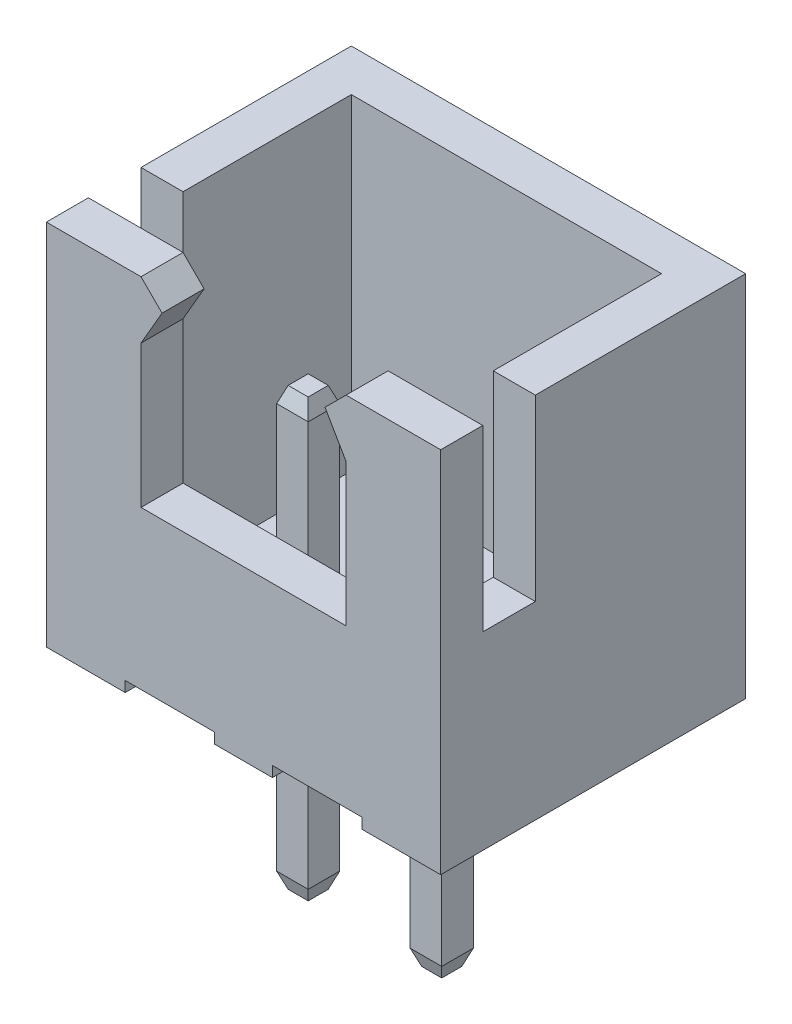
from build123d import *
from OCP.BRepFilletAPI import BRepFilletAPI_MakeChamfer

# Parameters (mm, degrees)
SKETCH_1_W               = 7.5
SKETCH_1_H               = 5.8
EXTRUDE_1_DEPTH          = 7
CUT_EXTRUDE_1_DEPTH      = 9.454140997
CUT_EXTRUDE_1_DEPTH_BACK = 9.454140997
SKETCH_2_W               = 1.7
SKETCH_2_H               = 0.2
SKETCH_3_W               = 5.9
SKETCH_3_H               = 4.2
CUT_EXTRUDE_2_DEPTH      = 6.2
CUT_EXTRUDE_3_DEPTH      = 1
CUT_EXTRUDE_4_DEPTH      = 9.454140997
CUT_EXTRUDE_4_DEPTH_BACK = 9.454140997
SKETCH_5_W               = 1
SKETCH_5_H               = 3.4
SKETCH_6_W               = 0.6
SKETCH_6_H               = 0.6
EXTRUDE_3_DEPTH          = 4.2
SKETCH_7_W               = 0.6
SKETCH_7_H               = 0.6
EXTRUDE_4_DEPTH          = 3.5
CHAMFER_1_SIZE           = 0.3
CHAMFER_1_SIZE2          = 0.10919107


with BuildPart() as part:
    # 草图1 → 凸台-拉伸1 (new body)
    with BuildSketch(Plane(origin=(0, 0, 0), x_dir=(1, 0, 0), z_dir=(0, 1, 0))):
        Rectangle(SKETCH_1_W, SKETCH_1_H)
    extrude(amount=EXTRUDE_1_DEPTH)

    # 草图2 → 切除-拉伸1 (cut, two sides: drawn at the far end of the back side and taken through both)
    with BuildSketch(Plane.XY.offset(-CUT_EXTRUDE_1_DEPTH_BACK)):
        with Locations((-1.4, 0.1)):
            Rectangle(SKETCH_2_W, SKETCH_2_H)
        with Locations((1.4, 0.1)):
            Rectangle(SKETCH_2_W, SKETCH_2_H)
    extrude(amount=CUT_EXTRUDE_1_DEPTH + CUT_EXTRUDE_1_DEPTH_BACK, mode=Mode.SUBTRACT)

    # 草图3 → 切除-拉伸2 (cut)
    with BuildSketch(Plane(origin=(0, 7, 0), x_dir=(1, 0, 0), z_dir=(0, 1, 0))):
        Rectangle(SKETCH_3_W, SKETCH_3_H)
    extrude(amount=-CUT_EXTRUDE_2_DEPTH, mode=Mode.SUBTRACT)

    # 草图4 → 切除-拉伸3 (cut)
    with BuildSketch(Plane.XY.offset(2.9)):
        Polygon((-1.95, 7), (-1.55, 6.6), (-1.95, 5.907179677), (-1.95, 3.2), (1.95, 3.2), (1.95, 5.907179677), (1.55, 6.6), (1.95, 7), align=None)
    extrude(amount=-CUT_EXTRUDE_3_DEPTH, mode=Mode.SUBTRACT)

    # 草图5 → 切除-拉伸4 (cut, two sides: drawn at the far end of the back side and taken through both)
    with BuildSketch(Plane.ZY.offset(-CUT_EXTRUDE_4_DEPTH_BACK)):
        with Locations((1.6, 5.3)):
            Rectangle(SKETCH_5_W, SKETCH_5_H)
    extrude(amount=CUT_EXTRUDE_4_DEPTH + CUT_EXTRUDE_4_DEPTH_BACK, mode=Mode.SUBTRACT)

    # 草图6 → 凸台-拉伸3 (add)
    with BuildSketch(Plane.XZ.offset(-0.2)):
        with Locations((-1.27, 0.4)):
            Rectangle(SKETCH_6_W, SKETCH_6_H)
        with Locations((1.27, 0.4)):
            Rectangle(SKETCH_6_W, SKETCH_6_H)
    extrude(amount=EXTRUDE_3_DEPTH)

    # 草图7 → 凸台-拉伸4 (add)
    with BuildSketch(Plane(origin=(0, 0.8, 0), x_dir=(1, 0, 0), z_dir=(0, 1, 0))):
        with Locations((1.27, -0.4)):
            Rectangle(SKETCH_7_W, SKETCH_7_H)
        with Locations((-1.27, -0.4)):
            Rectangle(SKETCH_7_W, SKETCH_7_H)
    extrude(amount=EXTRUDE_4_DEPTH)

    # 倒角1: one chamfer whose edges measure the first distance from different faces: ONE call of the kernel's chamfer builder (chamfer() names one face for all edges)
    chamfer_1_edges_1 = [part.edges().sort_by_distance(p)[0] for p in [
        (-1.27, -4, 0.7),
    ]]
    chamfer_1_side_1 = [part.faces().sort_by_distance(p)[0] for p in [
        (-1.27, -1.9, 0.7),
    ]]
    chamfer_1_edges_2 = [part.edges().sort_by_distance(p)[0] for p in [
        (-1.57, -4, 0.4),
    ]]
    chamfer_1_side_2 = [part.faces().sort_by_distance(p)[0] for p in [
        (-1.57, -1.9, 0.4),
    ]]
    chamfer_1_edges_3 = [part.edges().sort_by_distance(p)[0] for p in [
        (-1.27, -4, 0.1),
    ]]
    chamfer_1_side_3 = [part.faces().sort_by_distance(p)[0] for p in [
        (-1.27, -1.9, 0.1),
    ]]
    chamfer_1_edges_4 = [part.edges().sort_by_distance(p)[0] for p in [
        (-0.97, -4, 0.4),
    ]]
    chamfer_1_side_4 = [part.faces().sort_by_distance(p)[0] for p in [
        (-0.97, -1.9, 0.4),
    ]]
    chamfer_1_edges_5 = [part.edges().sort_by_distance(p)[0] for p in [
        (1.27, -4, 0.1),
    ]]
    chamfer_1_side_5 = [part.faces().sort_by_distance(p)[0] for p in [
        (1.27, -1.9, 0.1),
    ]]
    chamfer_1_edges_6 = [part.edges().sort_by_distance(p)[0] for p in [
        (1.57, -4, 0.4),
    ]]
    chamfer_1_side_6 = [part.faces().sort_by_distance(p)[0] for p in [
        (1.57, -1.9, 0.4),
    ]]
    chamfer_1_edges_7 = [part.edges().sort_by_distance(p)[0] for p in [
        (1.27, -4, 0.7),
    ]]
    chamfer_1_side_7 = [part.faces().sort_by_distance(p)[0] for p in [
        (1.27, -1.9, 0.7),
    ]]
    chamfer_1_edges_8 = [part.edges().sort_by_distance(p)[0] for p in [
        (0.97, -4, 0.4),
    ]]
    chamfer_1_side_8 = [part.faces().sort_by_distance(p)[0] for p in [
        (0.97, -1.9, 0.4),
    ]]
    chamfer_1_edges_9 = [part.edges().sort_by_distance(p)[0] for p in [
        (1.27, 4.3, 0.7),
    ]]
    chamfer_1_side_9 = [part.faces().sort_by_distance(p)[0] for p in [
        (1.27, 2.55, 0.7),
    ]]
    chamfer_1_edges_10 = [part.edges().sort_by_distance(p)[0] for p in [
        (1.57, 4.3, 0.4),
    ]]
    chamfer_1_side_10 = [part.faces().sort_by_distance(p)[0] for p in [
        (1.57, 2.55, 0.4),
    ]]
    chamfer_1_edges_11 = [part.edges().sort_by_distance(p)[0] for p in [
        (1.27, 4.3, 0.1),
    ]]
    chamfer_1_side_11 = [part.faces().sort_by_distance(p)[0] for p in [
        (1.27, 2.55, 0.1),
    ]]
    chamfer_1_edges_12 = [part.edges().sort_by_distance(p)[0] for p in [
        (0.97, 4.3, 0.4),
    ]]
    chamfer_1_side_12 = [part.faces().sort_by_distance(p)[0] for p in [
        (0.97, 2.55, 0.4),
    ]]
    chamfer_1_edges_13 = [part.edges().sort_by_distance(p)[0] for p in [
        (-1.57, 4.3, 0.4),
    ]]
    chamfer_1_side_13 = [part.faces().sort_by_distance(p)[0] for p in [
        (-1.57, 2.55, 0.4),
    ]]
    chamfer_1_edges_14 = [part.edges().sort_by_distance(p)[0] for p in [
        (-1.27, 4.3, 0.7),
    ]]
    chamfer_1_side_14 = [part.faces().sort_by_distance(p)[0] for p in [
        (-1.27, 2.55, 0.7),
    ]]
    chamfer_1_edges_15 = [part.edges().sort_by_distance(p)[0] for p in [
        (-0.97, 4.3, 0.4),
    ]]
    chamfer_1_side_15 = [part.faces().sort_by_distance(p)[0] for p in [
        (-0.97, 2.55, 0.4),
    ]]
    chamfer_1_edges_16 = [part.edges().sort_by_distance(p)[0] for p in [
        (-1.27, 4.3, 0.1),
    ]]
    chamfer_1_side_16 = [part.faces().sort_by_distance(p)[0] for p in [
        (-1.27, 2.55, 0.1),
    ]]
    chamfer_1 = BRepFilletAPI_MakeChamfer(part.part.solid().wrapped)
    for e in chamfer_1_edges_1:
        chamfer_1.Add(CHAMFER_1_SIZE, CHAMFER_1_SIZE2, e.wrapped, chamfer_1_side_1[0].wrapped)  # the first distance lies on this face
    for e in chamfer_1_edges_2:
        chamfer_1.Add(CHAMFER_1_SIZE, CHAMFER_1_SIZE2, e.wrapped, chamfer_1_side_2[0].wrapped)  # the first distance lies on this face
    for e in chamfer_1_edges_3:
        chamfer_1.Add(CHAMFER_1_SIZE, CHAMFER_1_SIZE2, e.wrapped, chamfer_1_side_3[0].wrapped)  # the first distance lies on this face
    for e in chamfer_1_edges_4:
        chamfer_1.Add(CHAMFER_1_SIZE, CHAMFER_1_SIZE2, e.wrapped, chamfer_1_side_4[0].wrapped)  # the first distance lies on this face
    for e in chamfer_1_edges_5:
        chamfer_1.Add(CHAMFER_1_SIZE, CHAMFER_1_SIZE2, e.wrapped, chamfer_1_side_5[0].wrapped)  # the first distance lies on this face
    for e in chamfer_1_edges_6:
        chamfer_1.Add(CHAMFER_1_SIZE, CHAMFER_1_SIZE2, e.wrapped, chamfer_1_side_6[0].wrapped)  # the first distance lies on this face
    for e in chamfer_1_edges_7:
        chamfer_1.Add(CHAMFER_1_SIZE, CHAMFER_1_SIZE2, e.wrapped, chamfer_1_side_7[0].wrapped)  # the first distance lies on this face
    for e in chamfer_1_edges_8:
        chamfer_1.Add(CHAMFER_1_SIZE, CHAMFER_1_SIZE2, e.wrapped, chamfer_1_side_8[0].wrapped)  # the first distance lies on this face
    for e in chamfer_1_edges_9:
        chamfer_1.Add(CHAMFER_1_SIZE, CHAMFER_1_SIZE2, e.wrapped, chamfer_1_side_9[0].wrapped)  # the first distance lies on this face
    for e in chamfer_1_edges_10:
        chamfer_1.Add(CHAMFER_1_SIZE, CHAMFER_1_SIZE2, e.wrapped, chamfer_1_side_10[0].wrapped)  # the first distance lies on this face
    for e in chamfer_1_edges_11:
        chamfer_1.Add(CHAMFER_1_SIZE, CHAMFER_1_SIZE2, e.wrapped, chamfer_1_side_11[0].wrapped)  # the first distance lies on this face
    for e in chamfer_1_edges_12:
        chamfer_1.Add(CHAMFER_1_SIZE, CHAMFER_1_SIZE2, e.wrapped, chamfer_1_side_12[0].wrapped)  # the first distance lies on this face
    for e in chamfer_1_edges_13:
        chamfer_1.Add(CHAMFER_1_SIZE, CHAMFER_1_SIZE2, e.wrapped, chamfer_1_side_13[0].wrapped)  # the first distance lies on this face
    for e in chamfer_1_edges_14:
        chamfer_1.Add(CHAMFER_1_SIZE, CHAMFER_1_SIZE2, e.wrapped, chamfer_1_side_14[0].wrapped)  # the first distance lies on this face
    for e in chamfer_1_edges_15:
        chamfer_1.Add(CHAMFER_1_SIZE, CHAMFER_1_SIZE2, e.wrapped, chamfer_1_side_15[0].wrapped)  # the first distance lies on this face
    for e in chamfer_1_edges_16:
        chamfer_1.Add(CHAMFER_1_SIZE, CHAMFER_1_SIZE2, e.wrapped, chamfer_1_side_16[0].wrapped)  # the first distance lies on this face
    add(Compound.cast(chamfer_1.Shape()), mode=Mode.REPLACE)


solid = part.part
